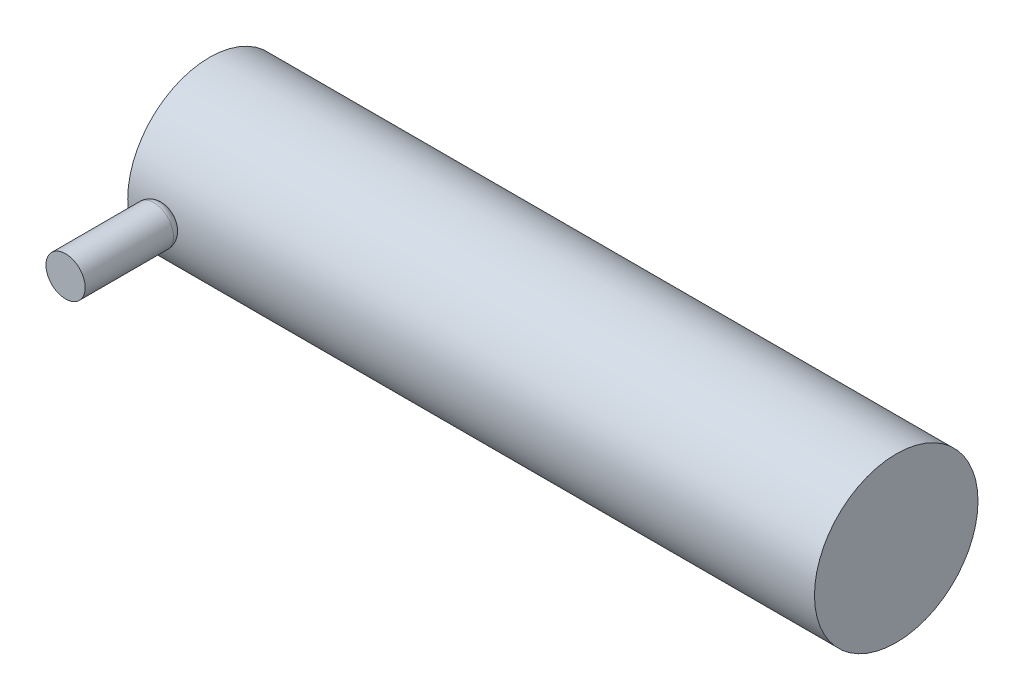
from build123d import *

# Parameters (mm, degrees)
SKETCH1_R           = 25
BOSS_EXTRUDE1_DEPTH = 210
BOSS_EXTRUDE2_START = 25
SKETCH2_R           = 6
BOSS_EXTRUDE2_DEPTH = 30
FILLET1_R           = 3


with BuildPart() as part:
    # Sketch1 → Boss-Extrude1 (new body)
    with BuildSketch(Plane(origin=(0, 0, 0), x_dir=(0, 0, -1), z_dir=(1, 0, 0))):
        Circle(SKETCH1_R)
    extrude(amount=-BOSS_EXTRUDE1_DEPTH)


with BuildPart() as body_2:
    # Sketch2 → Boss-Extrude2 (new body)
    with BuildSketch(Plane.XY.offset(BOSS_EXTRUDE2_START)):
        with Locations((-199, 0)):
            Circle(SKETCH2_R)
    extrude(amount=BOSS_EXTRUDE2_DEPTH)

    # Fillet1
    fillet1_edges = [body_2.edges().sort_by_distance(p)[0] for p in [
        (-205, 0, 25),
    ]]
    fillet(fillet1_edges, radius=FILLET1_R)


solid = Compound([part.part, body_2.part])
